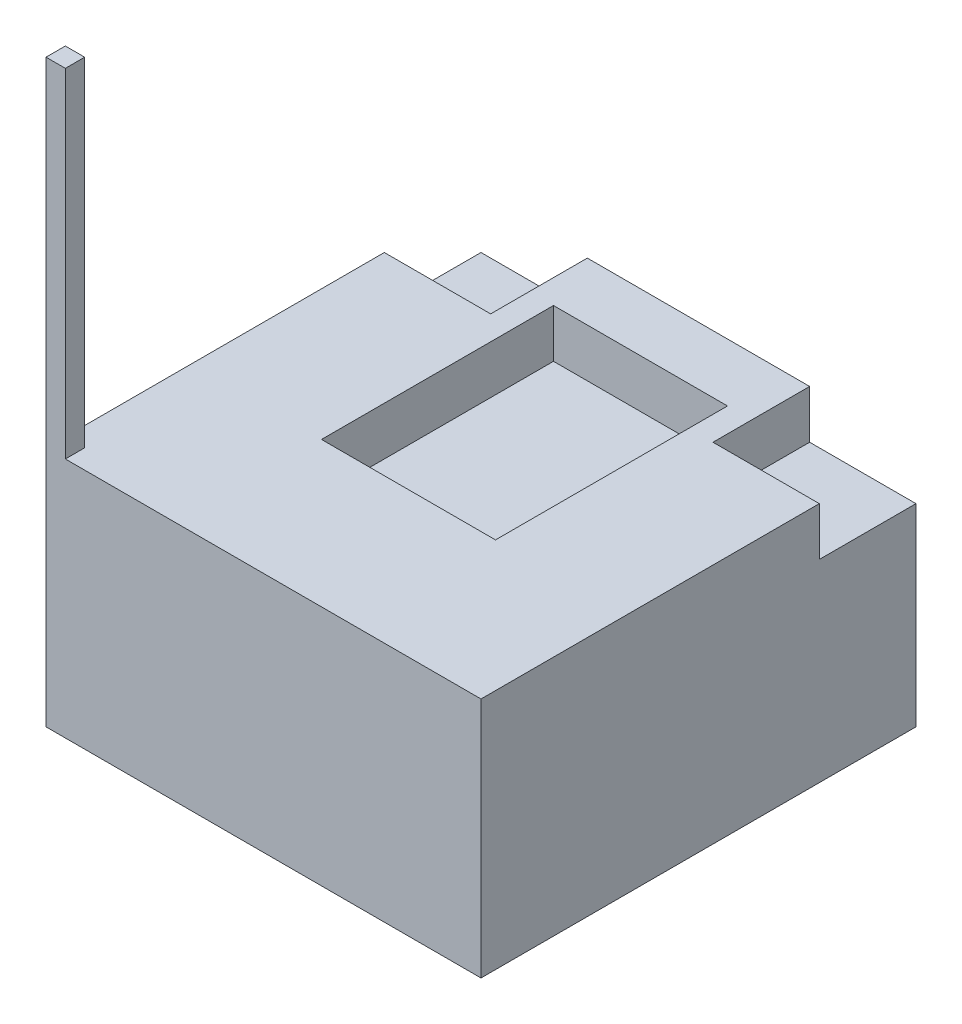
from build123d import *

# Parameters (mm, degrees)
SKETCH_1_W          = 450
SKETCH_1_H          = 450
EXTRUDE_1_DEPTH     = 250
SKETCH_2_W          = 180
SKETCH_2_H          = 240
CUT_EXTRUDE_1_DEPTH = 50
SKETCH_3_W          = 110
SKETCH_3_H          = 100
CUT_EXTRUDE_2_DEPTH = 50
SKETCH_4_W          = 8
SKETCH_4_H          = 12
CUT_EXTRUDE_3_DEPTH = 20
SKETCH_5_W          = 8
SKETCH_5_H          = 12
CUT_EXTRUDE_4_DEPTH = 20
SKETCH_6_W          = 20
SKETCH_6_H          = 20
EXTRUDE_2_DEPTH     = 600
SKETCH_7_W          = 20
SKETCH_7_H          = 20
EXTRUDE_3_DEPTH     = 600


with BuildPart() as part:
    # 草图1 → 凸台-拉伸1 (new body)
    with BuildSketch(Plane(origin=(0, 0, 0), x_dir=(1, 0, 0), z_dir=(0, 1, 0))):
        Rectangle(SKETCH_1_W, SKETCH_1_H)
    extrude(amount=EXTRUDE_1_DEPTH)

    # 草图2 → 切除-拉伸1 (cut)
    with BuildSketch(Plane(origin=(0, 250, 0), x_dir=(1, 0, 0), z_dir=(0, 1, 0))):
        with Locations((0, 45)):
            Rectangle(SKETCH_2_W, SKETCH_2_H)
    extrude(amount=-CUT_EXTRUDE_1_DEPTH, mode=Mode.SUBTRACT)

    # 草图3 → 切除-拉伸2 (cut)
    with BuildSketch(Plane(origin=(0, 250, 0), x_dir=(1, 0, 0), z_dir=(0, 1, 0))):
        with Locations((-170, 175)):
            Rectangle(SKETCH_3_W, SKETCH_3_H)
        with Locations((170, 175)):
            Rectangle(SKETCH_3_W, SKETCH_3_H)
    extrude(amount=-CUT_EXTRUDE_2_DEPTH, mode=Mode.SUBTRACT)

    # 草图4 → 切除-拉伸3 (cut)
    with BuildSketch(Plane(origin=(0, 0, -225), x_dir=(-1, 0, 0), z_dir=(0, 0, -1))):
        with Locations((-101, 236)):
            Rectangle(SKETCH_4_W, SKETCH_4_H)
        with Locations((101, 236)):
            Rectangle(SKETCH_4_W, SKETCH_4_H)
    extrude(amount=-CUT_EXTRUDE_3_DEPTH, mode=Mode.SUBTRACT)

    # 草图5 → 切除-拉伸4 (cut)
    with BuildSketch(Plane(origin=(0, 0, -125), x_dir=(-1, 0, 0), z_dir=(0, 0, -1))):
        with Locations((216, 236)):
            Rectangle(SKETCH_5_W, SKETCH_5_H)
    extrude(amount=-CUT_EXTRUDE_4_DEPTH, mode=Mode.SUBTRACT)

    # 草图6 → 凸台-拉伸2 (add)
    with BuildSketch(Plane.XZ):
        with Locations((-215, 215)):
            Rectangle(SKETCH_6_W, SKETCH_6_H)
    extrude(amount=-EXTRUDE_2_DEPTH)

    # 草图7 → 凸台-拉伸3 (add)
    with BuildSketch(Plane.XY.offset(225)):
        with Locations((-215, 10)):
            Rectangle(SKETCH_7_W, SKETCH_7_H)
    extrude(amount=-EXTRUDE_3_DEPTH)


solid = part.part
